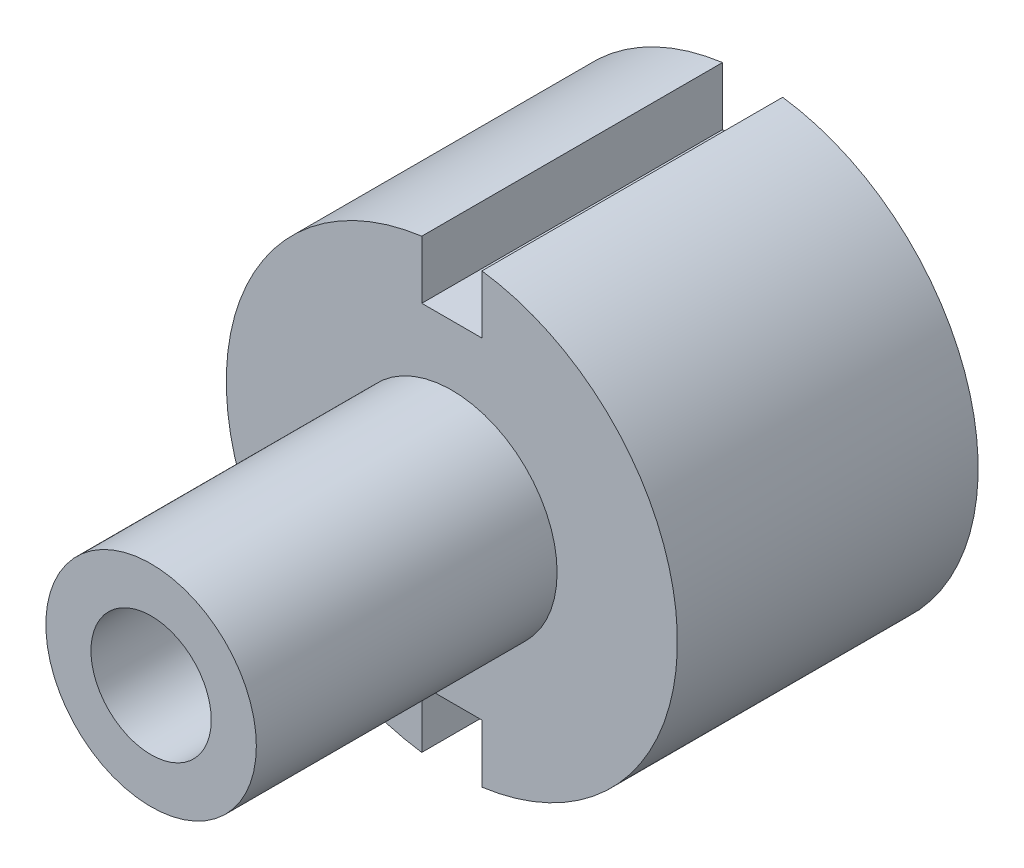
from build123d import *
from build123d.topology import SkipClean

# Parameters (mm, degrees)
SKETCH_1_R               = 7.5
EXTRUDE_1_DEPTH          = 5
SKETCH_6_R               = 3.5
EXTRUDE_2_DEPTH          = 10
SKETCH_7_R               = 2
CUT_EXTRUDE_1_DEPTH      = 3
CUT_EXTRUDE_2_DEPTH      = 21.03746491
CUT_EXTRUDE_2_DEPTH_BACK = 7
SKETCH_10_W              = 2
SKETCH_10_H              = 2
CUT_EXTRUDE_4_DEPTH      = 10


with BuildPart() as part:
    # Эскиз1 → Бобышка-Вытянуть1 (new, symmetric)
    with BuildSketch(Plane.XY):
        Circle(SKETCH_1_R)
    extrude(amount=EXTRUDE_1_DEPTH, both=True)

    # Эскиз6 → Бобышка-Вытянуть2 (add)
    with BuildSketch(Plane.XY.offset(5)):
        Circle(SKETCH_6_R)
    extrude(amount=EXTRUDE_2_DEPTH)

    # Эскиз7 → Вырез-Вытянуть1 (cut)
    with BuildSketch(Plane.XY.offset(15)):
        Circle(SKETCH_7_R)
    extrude(amount=-CUT_EXTRUDE_1_DEPTH, mode=Mode.SUBTRACT)

    # Эскиз8 → Вырез-Вытянуть2 (cut, two sides: drawn at the far end of the back side and taken through both)
    with SkipClean():  # the faces are left unmerged after this step: merging them gives an invalid solid
        with BuildSketch(Plane.XY.offset(12).offset(-CUT_EXTRUDE_2_DEPTH_BACK)):
            with BuildLine():
                Line((1.263922466, 1.55), (-1.263922466, 1.55))
                ThreePointArc((-1.263922466, 1.55), (-0.85794961, -1.806632908), (2, 0))
                ThreePointArc((2, 0), (1.806632908, 0.85794961), (1.263922466, 1.55))
            make_face()
        extrude(amount=CUT_EXTRUDE_2_DEPTH + CUT_EXTRUDE_2_DEPTH_BACK, mode=Mode.SUBTRACT)

    # Эскиз10 → Вырез-Вытянуть4 (cut)
    with SkipClean():  # the faces are left unmerged after this step: merging them gives an invalid solid
        with BuildSketch(Plane.XY.offset(5)):
            with Locations((0, 6.5)):
                Rectangle(SKETCH_10_W, SKETCH_10_H)
            with Locations((0, -6.5)):
                Rectangle(SKETCH_10_W, SKETCH_10_H)
        extrude(amount=-CUT_EXTRUDE_4_DEPTH, mode=Mode.SUBTRACT)


solid = part.part
